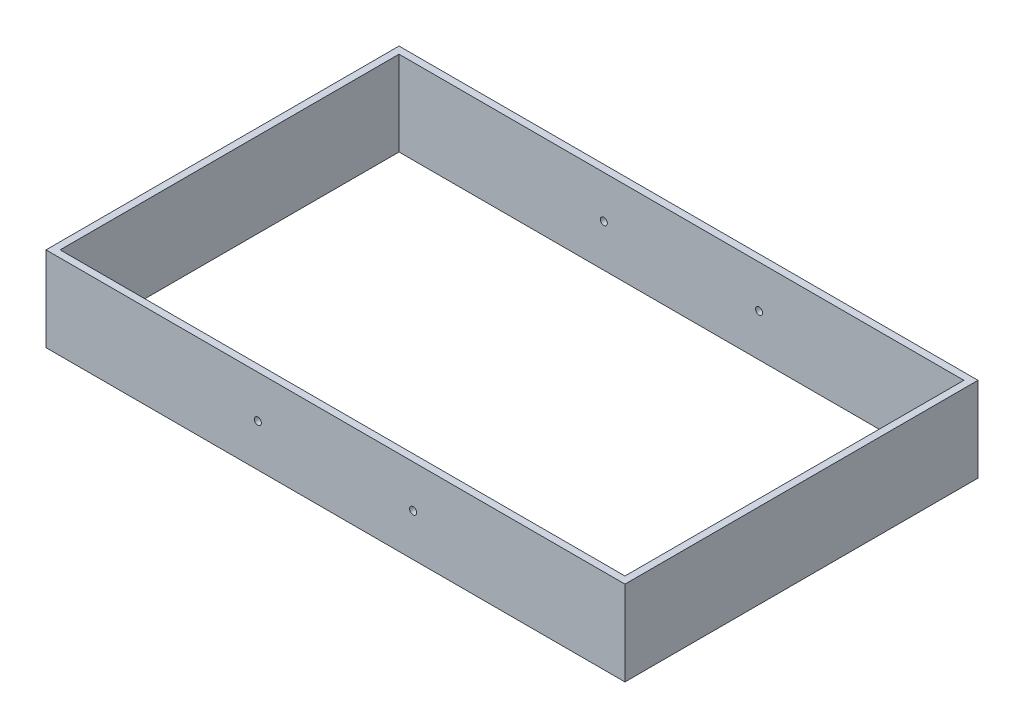
from build123d import *

# Parameters (mm, degrees)
SKETCH4_W           = 260.35
SKETCH4_H           = 158.75
SKETCH4_W_2         = 254
SKETCH4_H_2         = 152.4
BOSS_EXTRUDE1_DEPTH = 38.1
SKETCH5_R           = 1.5875
CUT_EXTRUDE1_DEPTH  = 305.618044648
SKETCH5_4_R         = 1.5875
CUT_EXTRUDE2_DEPTH  = 305.618044648


with BuildPart() as part:
    # Sketch4 → Boss-Extrude1 (new body)
    with BuildSketch(Plane(origin=(0, 0, 0), x_dir=(1, 0, 0), z_dir=(0, 1, 0))):
        with Locations((127, 76.2)):
            Rectangle(SKETCH4_W, SKETCH4_H)
        with Locations((127, 76.2)):
            Rectangle(SKETCH4_W_2, SKETCH4_H_2, mode=Mode.SUBTRACT)
    extrude(amount=BOSS_EXTRUDE1_DEPTH)

    # Sketch5 → Cut-Extrude1 (cut, through all)
    with BuildSketch(Plane.XY.offset(3.175)):
        with Locations((92.075, 19.05)):
            Circle(SKETCH5_R)
    extrude(amount=-CUT_EXTRUDE1_DEPTH, mode=Mode.SUBTRACT)

    # Sketch5<4> → Cut-Extrude2 (cut, through all)
    with BuildSketch(Plane.XY.offset(3.175)):
        with Locations((161.925, 19.05)):
            Circle(SKETCH5_4_R)
    extrude(amount=-CUT_EXTRUDE2_DEPTH, mode=Mode.SUBTRACT)


solid = part.part
